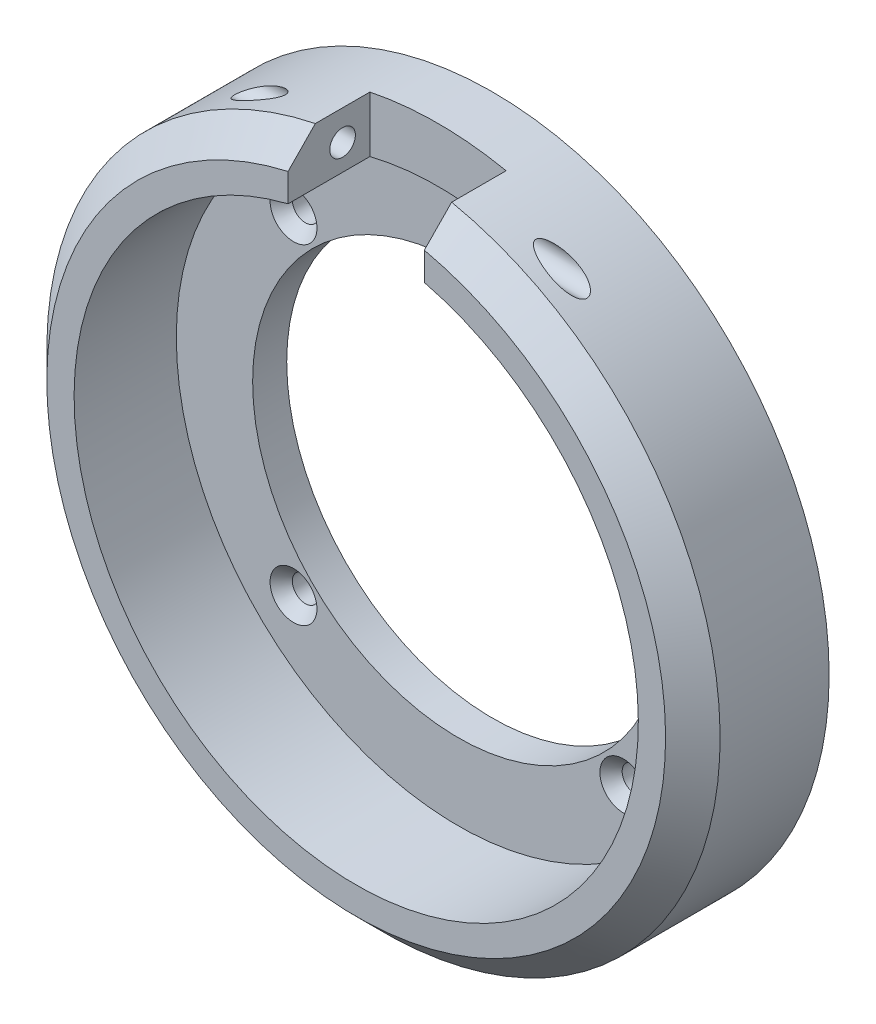
from build123d import *

# Parameters (mm, degrees)
SKETCH1_R                                         = 31.369
BOSS_EXTRUDE1_DEPTH                               = 12.7
SKETCH2_R                                         = 19.177
CUT_EXTRUDE1_DEPTH                                = 47.144537293
CUT_EXTRUDE2_START                                = -9.525
SKETCH3_R                                         = 26.289
CUT_EXTRUDE2_DEPTH                                = 9.525
CHAMFER1_SIZE                                     = 2.54
CSK_FOR_2_FLAT_HEAD_MACHINE_SCREW_100_D           = 2.4384
CSK_FOR_2_FLAT_HEAD_MACHINE_SCREW_100_CSINK_D     = 4.3688
CSK_FOR_2_FLAT_HEAD_MACHINE_SCREW_100_CSINK_ANGLE = 82
F_4_40_TAPPED_HOLE1_D                             = 2.2606
F_4_40_TAPPED_HOLE1_DEPTH                         = 7.5946
F_4_40_TAPPED_HOLE1_CSINK_D                       = 3.175
F_4_40_TAPPED_HOLE1_CSINK_ANGLE                   = 90
F_4_40_TAPPED_HOLE1_TIP                           = 0.679152758
SKETCH12_W                                        = 12.7
SKETCH12_H                                        = 8.945423361
CUT_EXTRUDE3_DEPTH                                = 7.62
CUT_EXTRUDE4_DEPTH                                = 51.675705442
CUT_EXTRUDE4_DEPTH_BACK                           = 51.675705442
SKETCH13_R                                        = 1.1938


with BuildPart() as part:
    # Sketch1 → Boss-Extrude1 (new body)
    with BuildSketch(Plane.XY):
        Circle(SKETCH1_R)
    extrude(amount=BOSS_EXTRUDE1_DEPTH)

    # Sketch2 → Cut-Extrude1 (cut, through all)
    with BuildSketch(Plane(origin=(0, 0, 0), x_dir=(-1, 0, 0), z_dir=(0, 0, -1))):
        Circle(SKETCH2_R)
    extrude(amount=-CUT_EXTRUDE1_DEPTH, mode=Mode.SUBTRACT)

    # Sketch3 → Cut-Extrude2 (cut)
    with BuildSketch(Plane.XY.offset(12.7).offset(CUT_EXTRUDE2_START)):
        Circle(SKETCH3_R)
    extrude(amount=CUT_EXTRUDE2_DEPTH, mode=Mode.SUBTRACT)

    # Chamfer1
    chamfer1_edges = [part.edges().sort_by_distance(p)[0] for p in [
        (-31.369, 0, 12.7),
    ]]
    chamfer(chamfer1_edges, length=CHAMFER1_SIZE)

    # CSK for #2 Flat Head Machine Screw (100)1 (through all)
    with Locations(Plane.XY.offset(3.175)):
        with Locations((-15.367, -15.367), (-15.367, 15.367), (15.367, 15.367), (15.367, -15.367)):
            CounterSinkHole(CSK_FOR_2_FLAT_HEAD_MACHINE_SCREW_100_D / 2, CSK_FOR_2_FLAT_HEAD_MACHINE_SCREW_100_CSINK_D / 2, counter_sink_angle=CSK_FOR_2_FLAT_HEAD_MACHINE_SCREW_100_CSINK_ANGLE)

    # #4-40 Tapped Hole1
    with Locations(Plane(origin=(0, 0, 0), x_dir=(-1, 0, 0), z_dir=(0, 0, -1))):
        with Locations((-20.32, 20.32), (20.32, 20.32), (20.32, -20.32), (-20.32, -20.32)):
            CounterSinkHole(F_4_40_TAPPED_HOLE1_D / 2, F_4_40_TAPPED_HOLE1_CSINK_D / 2, depth=F_4_40_TAPPED_HOLE1_DEPTH, counter_sink_angle=F_4_40_TAPPED_HOLE1_CSINK_ANGLE)
            with Locations((0, 0, -(F_4_40_TAPPED_HOLE1_DEPTH + F_4_40_TAPPED_HOLE1_TIP / 2))):  # 118° drill point
                Cone(0, F_4_40_TAPPED_HOLE1_D / 2, F_4_40_TAPPED_HOLE1_TIP, mode=Mode.SUBTRACT)

    # Sketch12 → Cut-Extrude3 (cut)
    with BuildSketch(Plane.XY.offset(12.7)):
        with Locations((0, 26.89628832)):
            Rectangle(SKETCH12_W, SKETCH12_H)
    extrude(amount=-CUT_EXTRUDE3_DEPTH, mode=Mode.SUBTRACT)

    # Sketch13 → Cut-Extrude4 (cut, two sides: drawn at the far end of the back side and taken through both)
    with BuildSketch(Plane(origin=(-6.35, 0, 0), x_dir=(0, 0, -1), z_dir=(1, 0, 0)).offset(-CUT_EXTRUDE4_DEPTH_BACK)):
        with Locations(Location((-7.62, 27.925564792, 0), (0, 0, 90))):
            Circle(SKETCH13_R)
    extrude(amount=CUT_EXTRUDE4_DEPTH + CUT_EXTRUDE4_DEPTH_BACK, mode=Mode.SUBTRACT)


solid = part.part
